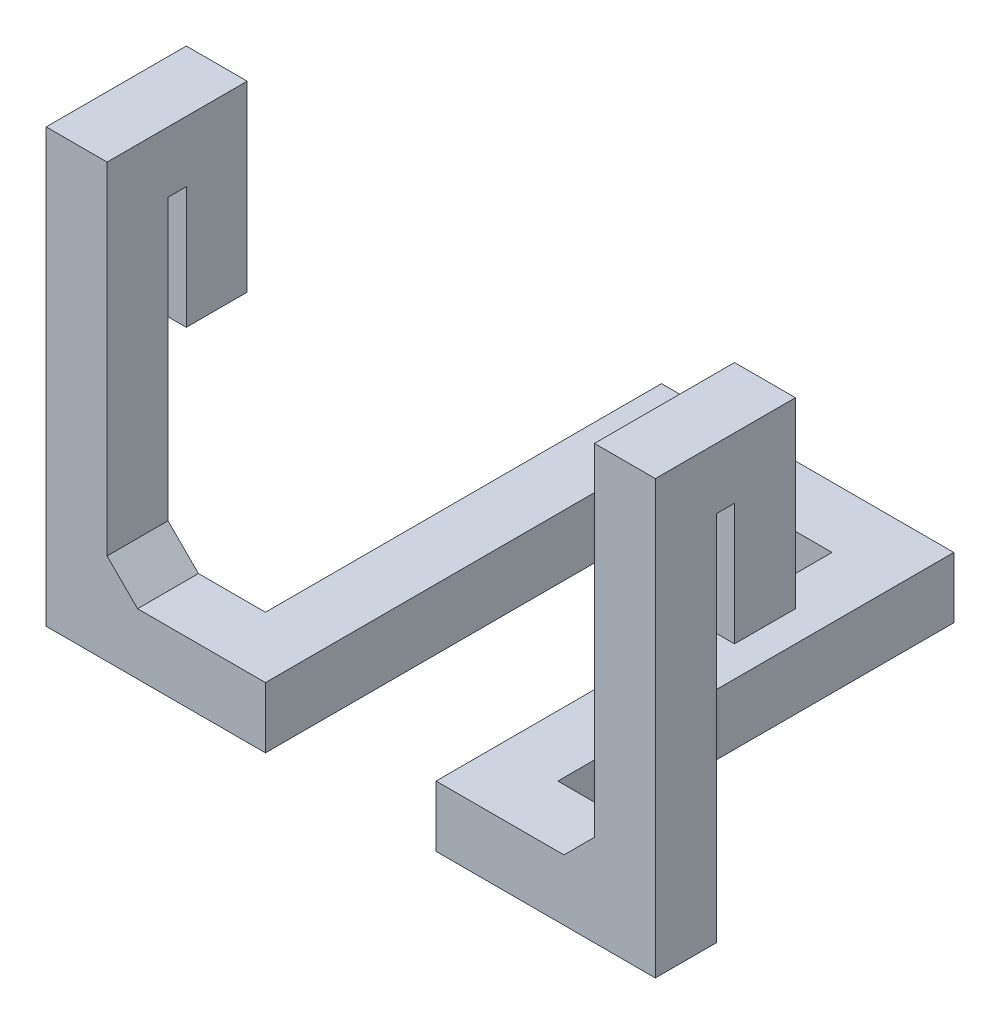
from build123d import *

# Parameters (mm, degrees)
BOSS_EXTRUDE1_DEPTH = 10
BOSS_EXTRUDE2_DEPTH = 10
BOSS_EXTRUDE3_DEPTH = 10
FILLET1_SIZE        = 5


with BuildPart() as part:
    # Sketch1 → Boss-Extrude1 (new body)
    with BuildSketch(Plane(origin=(0, 0, 0), x_dir=(0, 0, -1), z_dir=(1, 0, 0))):
        Polygon((0, 0), (0, 71), (23, 71), (23, 41), (13, 41), (13, 61), (10, 61), (10, 0), align=None)
    extrude(amount=BOSS_EXTRUDE1_DEPTH)

    # Sketch2 → Boss-Extrude2 (add)
    with BuildSketch(Plane(origin=(0, 0, 0), x_dir=(1, 0, 0), z_dir=(0, 1, 0))):
        Polygon((10, 0), (36, 0), (36, 65), (50, 65), (64, 65), (64, 0), (90, 0), (90, 10), (74, 10), (74, 75), (50, 75), (26, 75), (26, 10), (10, 10), align=None)
    extrude(amount=BOSS_EXTRUDE2_DEPTH)

    # Sketch3 → Boss-Extrude3 (add)
    with BuildSketch(Plane(origin=(90, 0, 0), x_dir=(0, 0, -1), z_dir=(1, 0, 0))):
        Polygon((0, 71), (0, 0), (10, 0), (10, 61), (13, 61), (13, 41), (23, 41), (23, 71), align=None)
    extrude(amount=BOSS_EXTRUDE3_DEPTH)

    # Fillet1
    fillet1_edges = [part.edges().sort_by_distance(p)[0] for p in [
        (10, 10, -5),
        (90, 10, -5),
    ]]
    chamfer(fillet1_edges, length=FILLET1_SIZE)


solid = part.part
